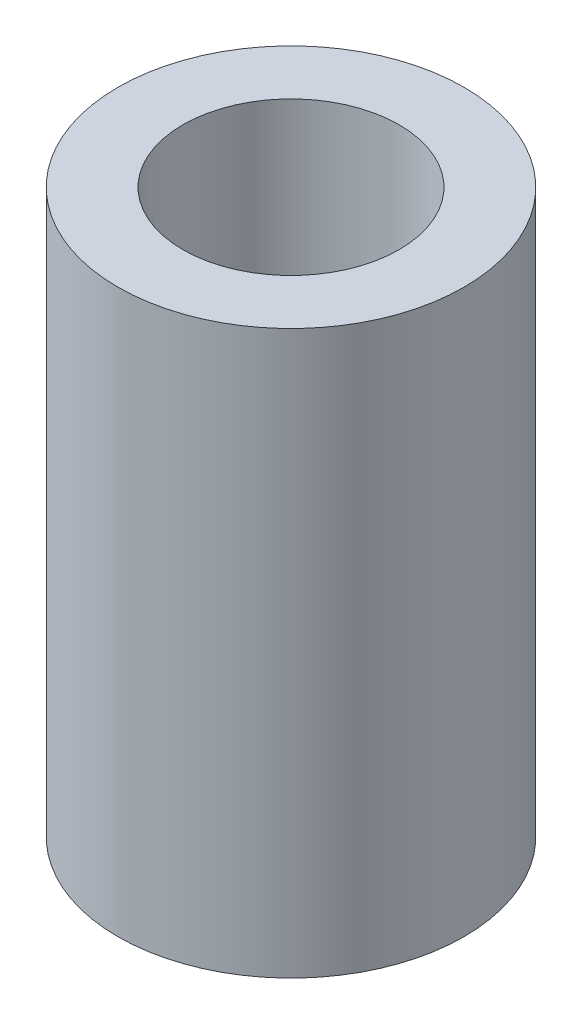
from build123d import *

# Parameters (mm, degrees)
SKETCH1_R           = 4
SKETCH1_R_2         = 2.5
BOSS_EXTRUDE1_DEPTH = 13


with BuildPart() as part:
    # Sketch1 → Boss-Extrude1 (new body)
    with BuildSketch(Plane(origin=(0, 0, 0), x_dir=(1, 0, 0), z_dir=(0, 1, 0))):
        with Locations(Location((0, 0, 0), (0, 0, 90))):
            Circle(SKETCH1_R)
        with Locations(Location((0, 0, 0), (0, 0, 90))):
            Circle(SKETCH1_R_2, mode=Mode.SUBTRACT)
    extrude(amount=BOSS_EXTRUDE1_DEPTH)


solid = part.part
